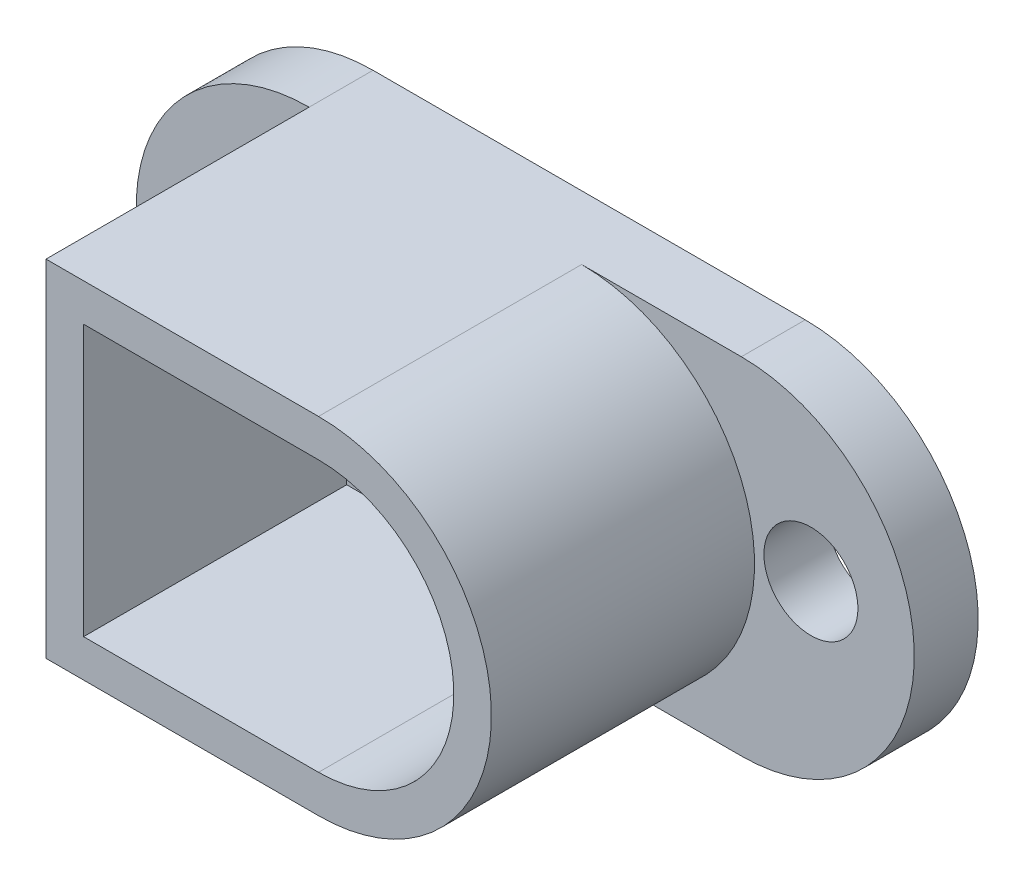
from build123d import *

# Parameters (mm, degrees)
BOSS_EXTRU_1_DEPTH = 7
ESQUISSE2_R        = 1.25
BOSS_EXTRU_2_DEPTH = 1.7


with BuildPart() as part:
    # Esquisse1 → Boss.-Extru.1 (new body)
    with BuildSketch(Plane.XY):
        with BuildLine():
            Line((-7.25, -4.6), (-7.25, 4.6))
            Line((-7.25, 4.6), (0, 4.6))
            ThreePointArc((0, 4.6), (4.6, 0), (0, -4.6))
            Line((0, -4.6), (-7.25, -4.6))
        make_face()
        with BuildLine():
            Line((-6.25, -3.6), (-6.25, 3.6))
            Line((-6.25, 3.6), (0, 3.6))
            ThreePointArc((0, 3.6), (3.6, 0), (0, -3.6))
            Line((0, -3.6), (-6.25, -3.6))
        make_face(mode=Mode.SUBTRACT)
    extrude(amount=BOSS_EXTRU_1_DEPTH)

    # Esquisse2 → Boss.-Extru.2 (add)
    with BuildSketch(Plane(origin=(0, 0, 0), x_dir=(-1, 0, 0), z_dir=(0, 0, -1))):
        with BuildLine():
            Line((7.25, 4.6), (-4.25, 4.6))
            ThreePointArc((-4.25, 4.6), (-8.85, 0), (-4.25, -4.6))
            Line((-4.25, -4.6), (7.25, -4.6))
            ThreePointArc((7.25, -4.6), (11.85, 0), (7.25, 4.6))
        make_face()
        with Locations((9.1, 0.35)):
            Circle(ESQUISSE2_R, mode=Mode.SUBTRACT)
        with Locations((-6.1, 0.35)):
            Circle(ESQUISSE2_R, mode=Mode.SUBTRACT)
    extrude(amount=BOSS_EXTRU_2_DEPTH)


solid = part.part
